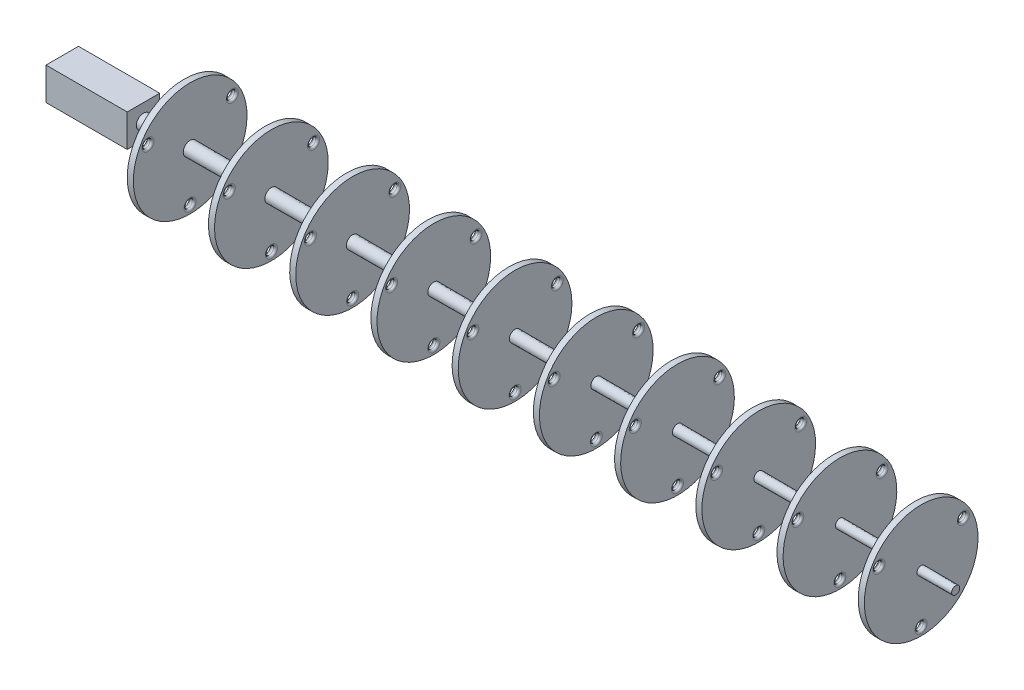
from build123d import *

# Parameters (mm, degrees)
SKETCH3_W              = 1.5
SKETCH3_H              = 14
CUT_EXTRUDE1_REACH     = 191.537
SKETCH5_R              = 1
FILLET1_R              = 0.5
LPATTERN1_COUNT        = 10
LPATTERN1_PITCH        = 20
FILLET1_OF_LPATTERN1_R = 0.5
SKETCH16_W             = 8
SKETCH16_H             = 8
BOSS_EXTRUDE1_DEPTH    = 20


with BuildPart() as part:
    # Sketch2 → Revolve1 (revolve)
    with BuildSketch(Plane.XY):
        Polygon((0, 1.75), (200, 1), (200, 0), (0, 0), align=None)
    revolve(axis=Axis((200, 0, 0), (-1, 0, 0)))

    # Sketch3 → Revolve2 (revolve)
    with BuildSketch(Plane.XY):
        with Locations((10.75, 7)):
            Rectangle(SKETCH3_W, SKETCH3_H)
    revolve2 = revolve(axis=Axis((11.5, 0, 0), (-1, 0, 0)))

    # Sketch5 → Cut-Extrude1 (cut, up to next)
    with BuildSketch(Plane(origin=(11.5, 0, 0), x_dir=(0, 0, -1), z_dir=(1, 0, 0)), mode=Mode.PRIVATE) as cut_extrude1_sk1:
        with Locations((0, -12)):
            Circle(SKETCH5_R)
    cut_extrude1_tool1 = extrude(cut_extrude1_sk1.sketch, amount=-CUT_EXTRUDE1_REACH, mode=Mode.PRIVATE) & part.part
    # Sketch5 → Cut-Extrude1 (cut, up to next)
    with BuildSketch(Plane(origin=(11.5, 0, 0), x_dir=(0, 0, -1), z_dir=(1, 0, 0)), mode=Mode.PRIVATE) as cut_extrude1_sk2:
        with Locations((10.392304845, 6)):
            Circle(SKETCH5_R)
    cut_extrude1_tool2 = extrude(cut_extrude1_sk2.sketch, amount=-CUT_EXTRUDE1_REACH, mode=Mode.PRIVATE) & part.part
    # Sketch5 → Cut-Extrude1 (cut, up to next)
    with BuildSketch(Plane(origin=(11.5, 0, 0), x_dir=(0, 0, -1), z_dir=(1, 0, 0)), mode=Mode.PRIVATE) as cut_extrude1_sk3:
        with Locations((-10.392304845, 6)):
            Circle(SKETCH5_R)
    cut_extrude1_tool3 = extrude(cut_extrude1_sk3.sketch, amount=-CUT_EXTRUDE1_REACH, mode=Mode.PRIVATE) & part.part
    cut_extrude1_1 = cut_extrude1_tool1.solids().sort_by_distance((11.5, -12, 0))[0]
    add(cut_extrude1_1, mode=Mode.SUBTRACT)
    cut_extrude1_2 = cut_extrude1_tool2.solids().sort_by_distance((11.5, 6, -10.392305))[0]
    add(cut_extrude1_2, mode=Mode.SUBTRACT)
    cut_extrude1_3 = cut_extrude1_tool3.solids().sort_by_distance((11.5, 6, 10.392305))[0]
    add(cut_extrude1_3, mode=Mode.SUBTRACT)
    cut_extrude1 = cut_extrude1_1 + cut_extrude1_2 + cut_extrude1_3  # Cut-Extrude1 as one shape, for the pattern or mirror that repeats it

    # Fillet1
    fillet1_edges = [part.edges().sort_by_distance(p)[0] for p in [
        (10, 6, -9.392304845),
        (10, -12, 1),
        (11.5, -12, 1),
        (11.5, 6, -9.392304845),
        (10, 6, 11.392304845),
        (11.5, 6, 11.392304845),
    ]]
    fillet(fillet1_edges, radius=FILLET1_R)

    # LPattern1: Revolve2, Cut-Extrude1 ×10
    with Locations(*[(i * LPATTERN1_PITCH, 0, 0) for i in range(1, LPATTERN1_COUNT)]):
        add(revolve2)
        add(cut_extrude1, mode=Mode.SUBTRACT)

    # Fillet1 of LPattern1
    fillet1_of_lpattern1_edges = [part.edges().sort_by_distance(p)[0] for p in [
        (30, 6, -9.392304845),
        (30, -12, 1),
        (31.5, -12, 1),
        (31.5, 6, -9.392304845),
        (30, 6, 11.392304845),
        (31.5, 6, 11.392304845),
        (50, 6, -9.392304845),
        (50, -12, 1),
        (51.5, -12, 1),
        (51.5, 6, -9.392304845),
        (50, 6, 11.392304845),
        (51.5, 6, 11.392304845),
        (70, 6, -9.392304845),
        (70, -12, 1),
        (71.5, -12, 1),
        (71.5, 6, -9.392304845),
        (70, 6, 11.392304845),
        (71.5, 6, 11.392304845),
        (90, 6, -9.392304845),
        (90, -12, 1),
        (91.5, -12, 1),
        (91.5, 6, -9.392304845),
        (90, 6, 11.392304845),
        (91.5, 6, 11.392304845),
        (110, 6, -9.392304845),
        (110, -12, 1),
        (111.5, -12, 1),
        (111.5, 6, -9.392304845),
        (110, 6, 11.392304845),
        (111.5, 6, 11.392304845),
        (130, 6, -9.392304845),
        (130, -12, 1),
        (131.5, -12, 1),
        (131.5, 6, -9.392304845),
        (130, 6, 11.392304845),
        (131.5, 6, 11.392304845),
        (150, 6, -9.392304845),
        (150, -12, 1),
        (151.5, -12, 1),
        (151.5, 6, -9.392304845),
        (150, 6, 11.392304845),
        (151.5, 6, 11.392304845),
        (170, 6, -9.392304845),
        (170, -12, 1),
        (171.5, -12, 1),
        (171.5, 6, -9.392304845),
        (170, 6, 11.392304845),
        (171.5, 6, 11.392304845),
        (190, 6, -9.392304845),
        (190, -12, 1),
        (191.5, -12, 1),
        (191.5, 6, -9.392304845),
        (190, 6, 11.392304845),
        (191.5, 6, 11.392304845),
    ]]
    fillet(fillet1_of_lpattern1_edges, radius=FILLET1_OF_LPATTERN1_R)

    # Sketch16 → Boss-Extrude1 (add)
    with BuildSketch(Plane.ZY):
        Rectangle(SKETCH16_W, SKETCH16_H)
    extrude(amount=BOSS_EXTRUDE1_DEPTH)


solid = part.part
